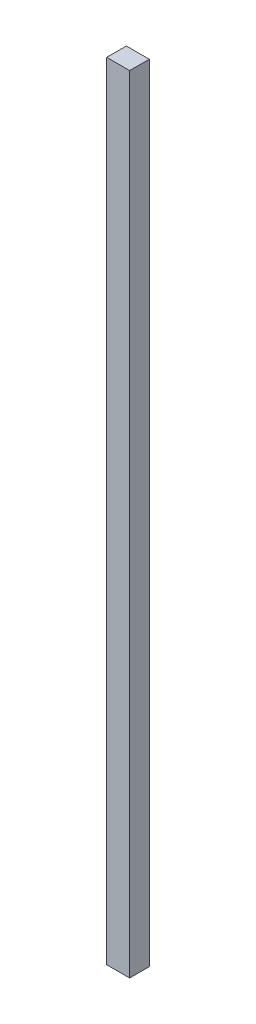
from build123d import *

# Parameters (mm, degrees)
SKETCH1_W           = 120
SKETCH1_H           = 3.5
BOSS_EXTRUDE1_DEPTH = 3


with BuildPart() as part:
    # Sketch1 → Boss-Extrude1 (new body)
    with BuildSketch(Plane(origin=(0, 0, 0), x_dir=(0, 1, 0), z_dir=(0, 0, 1))):
        Rectangle(SKETCH1_W, SKETCH1_H)
    extrude(amount=BOSS_EXTRUDE1_DEPTH)


solid = part.part
